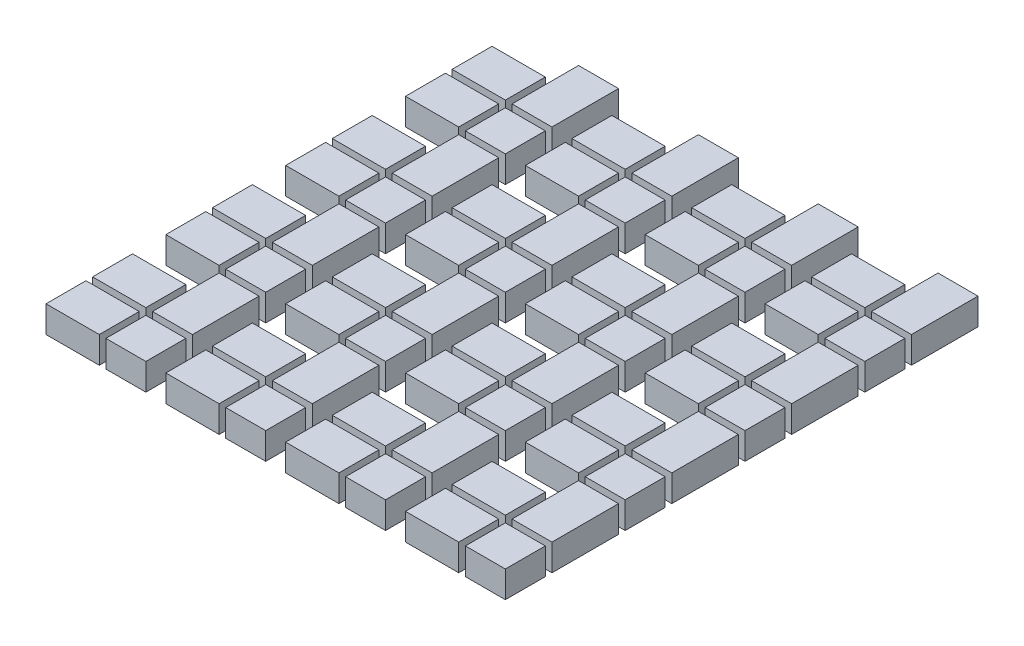
from build123d import *

# Parameters (mm, degrees)
SKETCH1_W             = 10.16
SKETCH1_H             = 7.62
BOSS_EXTRUDE1_DEPTH   = 5.08
SKETCH1_W_2           = 7.62
SKETCH1_H_2           = 12.7
BOSS_EXTRUDE1_2_DEPTH = 5.08
BOSS_EXTRUDE1_3_DEPTH = 5.08
BOSS_EXTRUDE1_4_DEPTH = 5.08
LPATTERN1_COUNT       = 4
LPATTERN1_PITCH       = 22.86
LPATTERN1_COUNT_DIR2  = 4
LPATTERN1_PITCH_DIR2  = 22.86


with BuildPart() as part:
    # Sketch1 → Boss-Extrude1 (new body)
    with BuildSketch(Plane(origin=(0, 0, 0), x_dir=(1, 0, 0), z_dir=(0, 1, 0))):
        with Locations((-10.16, 0)):
            Rectangle(SKETCH1_W, SKETCH1_H)
    boss_extrude1 = extrude(amount=BOSS_EXTRUDE1_DEPTH)


with BuildPart() as body_2:
    # Sketch1 → Boss-Extrude1 2 (new body)
    with BuildSketch(Plane(origin=(0, 0, 0), x_dir=(1, 0, 0), z_dir=(0, 1, 0))):
        with Locations((0, 11.43)):
            Rectangle(SKETCH1_W_2, SKETCH1_H_2)
    boss_extrude1_2 = extrude(amount=BOSS_EXTRUDE1_2_DEPTH)


with BuildPart() as body_3:
    # Sketch1 → Boss-Extrude1 3 (new body)
    with BuildSketch(Plane(origin=(0, 0, 0), x_dir=(1, 0, 0), z_dir=(0, 1, 0))):
        Rectangle(SKETCH1_W_2, SKETCH1_H)
    boss_extrude1_3 = extrude(amount=BOSS_EXTRUDE1_3_DEPTH)


with BuildPart() as body_4:
    # Sketch1 → Boss-Extrude1 4 (new body)
    with BuildSketch(Plane(origin=(0, 0, 0), x_dir=(1, 0, 0), z_dir=(0, 1, 0))):
        with Locations((-10.16, 8.89)):
            Rectangle(SKETCH1_W, SKETCH1_H)
    boss_extrude1_4 = extrude(amount=BOSS_EXTRUDE1_4_DEPTH)


with BuildPart() as lpattern1_1:
    # LPattern1: Boss-Extrude1, Boss-Extrude1 2, Boss-Extrude1 3, Boss-Extrude1 4 4 × 4
    with Locations(*[(-i * LPATTERN1_PITCH, 0, j * LPATTERN1_PITCH_DIR2) for i in range(LPATTERN1_COUNT) for j in range(LPATTERN1_COUNT_DIR2) if (i, j) != (0, 0)]):
        add(boss_extrude1)
        add(boss_extrude1_2)
        add(boss_extrude1_3)
        add(boss_extrude1_4)


solid = Compound([part.part, body_2.part, body_3.part, body_4.part, lpattern1_1.part])
